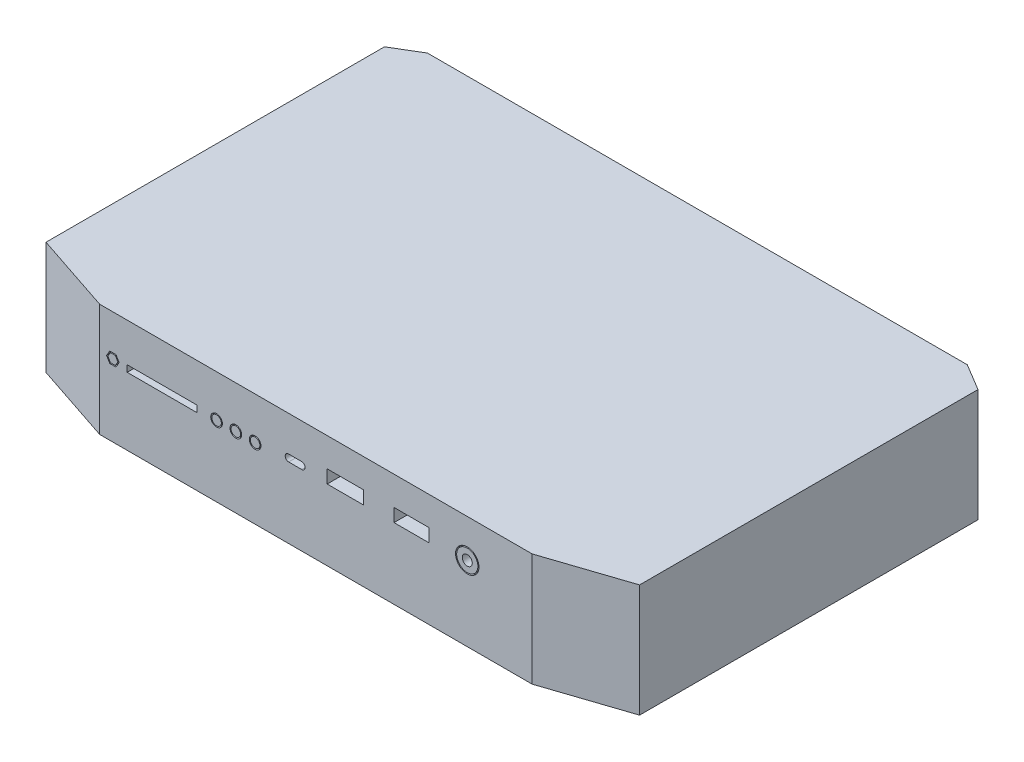
from build123d import *

# Parameters (mm, degrees)
SKETCH_1_W                   = 221
SKETCH_1_H                   = 142
EXTRUDE_1_DEPTH              = 42
HOLE_WIZARD_M2_1_D           = 1.6
HOLE_WIZARD_M2_1_DEPTH       = 6
HOLE_WIZARD_M2_1_CSINK_D     = 1.65
HOLE_WIZARD_M2_1_CSINK_ANGLE = 90
HOLE_WIZARD_M2_1_TIP         = 0.480688495
SKETCH_5_OUTSIDE_W           = 276.204
SKETCH_5_OUTSIDE_H           = 197.204
CUT_EXTRUDE_1_DEPTH          = 130
EXTRUDE_2_DEPTH              = 122
CUT_EXTRUDE_2_DEPTH          = 244
SKETCH_13_W                  = 16.438159635
SKETCH_13_H                  = 9.93572307
SKETCH_13_W_2                = 12.5754897
SKETCH_13_H_2                = 5.083708602
SKETCH_13_H_3                = 4.97630757
SKETCH_13_W_3                = 12.84305331
SKETCH_13_R                  = 2.136618389
SKETCH_13_R_2                = 4.382719539
CUT_EXTRUDE_3_DEPTH          = 5
SKETCH_14_R                  = 4.5
SKETCH_14_R_2                = 2.136618389
CUT_EXTRUDE_4_DEPTH          = 2
CUT_EXTRUDE_6_DEPTH          = 7
CUT_EXTRUDE_7_DEPTH          = 2
SKETCH_16_W                  = 25.979982462
SKETCH_16_H                  = 2.443258538
SKETCH_16_W_2                = 13.47848244
SKETCH_16_H_2                = 4.896726707
SKETCH_16_W_3                = 13.009082554
SKETCH_16_R                  = 1.865871028
CUT_EXTRUDE_8_DEPTH          = 7
SKETCH_16_3_R                = 4.363054392
SKETCH_16_3_R_2              = 3.946752021
SKETCH_16_3_R_3              = 2.173269591
SKETCH_16_3_R_4              = 1.773269591
CUT_EXTRUDE_9_DEPTH          = 1


with BuildPart() as part:
    # 草图1 → 凸台-拉伸1 (new body)
    with BuildSketch(Plane(origin=(0, 0, 0), x_dir=(1, 0, 0), z_dir=(0, 1, 0))):
        Rectangle(SKETCH_1_W, SKETCH_1_H)
    extrude(amount=EXTRUDE_1_DEPTH)

    # M2 螺纹孔的螺纹孔钻头1
    with Locations(Plane(origin=(0, 0, 0), x_dir=(-1, 0, 0), z_dir=(0, -1, 0))):
        with Locations((0, 45.7), (0, -46.4)):
            CounterSinkHole(HOLE_WIZARD_M2_1_D / 2, HOLE_WIZARD_M2_1_CSINK_D / 2, depth=HOLE_WIZARD_M2_1_DEPTH, counter_sink_angle=HOLE_WIZARD_M2_1_CSINK_ANGLE)
            with Locations((0, 0, -(HOLE_WIZARD_M2_1_DEPTH + HOLE_WIZARD_M2_1_TIP / 2))):  # 118° drill point
                Cone(0, HOLE_WIZARD_M2_1_D / 2, HOLE_WIZARD_M2_1_TIP, mode=Mode.SUBTRACT)

    # 草图5 outside → 切除-拉伸1 (cut)
    with BuildSketch(Plane.XZ):
        Rectangle(SKETCH_5_OUTSIDE_W, SKETCH_5_OUTSIDE_H)
        Polygon((-110.5, -65), (-100.5, -71), (100.5, -71), (110.5, -65), (110.5, 61), (80.5, 71), (-80.5, 71), (-110.5, 61), align=None, mode=Mode.SUBTRACT)
    extrude(amount=-CUT_EXTRUDE_1_DEPTH, mode=Mode.SUBTRACT)

    # 草图13 → 切除-拉伸3 (cut)
    with BuildSketch(Plane(origin=(0, 0, -71), x_dir=(-1, 0, 0), z_dir=(0, 0, -1))):
        with Locations((-62.342110878, 30.003254568)):
            Rectangle(SKETCH_13_W, SKETCH_13_H)
        with BuildLine():
            Line((14.946870507, 31.115026464), (9.712885643, 31.115026464))
            ThreePointArc((9.712885643, 31.115026464), (8.384859632, 29.787000454), (9.712885643, 28.458974443))
            Line((9.712885643, 28.458974443), (14.946870507, 28.458974443))
            ThreePointArc((14.946870507, 28.458974443), (16.274896517, 29.787000454), (14.946870507, 31.115026464))
        make_face()
        Polygon((39.457804396, 32.922800643), (25.386145104, 32.922800643), (25.386145104, 30.350561848), (27.466632365, 28.270074587), (37.377317135, 28.270074587), (39.457804396, 30.350561848), align=None)
        Polygon((56.866826337, 33.694786502), (48.092607233, 33.694786502), (48.092607233, 29.787000454), (50.08753298, 27.865629395), (54.87190059, 27.865629395), (56.866826337, 29.787000454), align=None)
        with Locations((-39.665036312, 34.649123031)):
            Rectangle(SKETCH_13_W_2, SKETCH_13_H_2)
        with Locations((-39.665036312, 25.319884014)):
            Rectangle(SKETCH_13_W_2, SKETCH_13_H_3)
        with Locations((-12.596517704, 34.649123031)):
            Rectangle(SKETCH_13_W_3, SKETCH_13_H_2)
        with Locations((-12.596517704, 25.319884014)):
            Rectangle(SKETCH_13_W_3, SKETCH_13_H_3)
        with Locations((-81.446088386, 29.134961074)):
            Circle(SKETCH_13_R)
        with Locations((79.401798223, 30.827059992)):
            Circle(SKETCH_13_R_2)
    extrude(amount=-CUT_EXTRUDE_3_DEPTH, mode=Mode.SUBTRACT)

    # 草图14 → 切除-拉伸4 (cut)
    with BuildSketch(Plane(origin=(0, 0, -71), x_dir=(-1, 0, 0), z_dir=(0, 0, -1))):
        with Locations((-81.446088386, 29.134961074)):
            Circle(SKETCH_14_R)
        with Locations((-81.446088386, 29.134961074)):
            Circle(SKETCH_14_R_2, mode=Mode.SUBTRACT)
    extrude(amount=-CUT_EXTRUDE_4_DEPTH, mode=Mode.SUBTRACT)

    # 草图15 → 切除-拉伸6 (cut)
    with BuildSketch(Plane(origin=(0, 0, -71), x_dir=(-1, 0, 0), z_dir=(0, 0, -1))):
        Polygon((-92.68249691, 18.806116893), (-99.112519076, 18.806116893), (-98.623712243, 14.751895509), (-92.011551822, 14.751895509), align=None)
        Polygon((-91.879157456, 13.951895509), (-98.527258342, 13.951895509), (-97.923276236, 8.942396867), (-91.050120709, 8.942396867), align=None)
        Polygon((-75.297304818, 18.806116893), (-91.871615743, 18.806116893), (-91.200670655, 14.751895509), (-75.518910584, 14.751895509), align=None)
        Polygon((-90.917726343, 8.142396867), (-97.826822335, 8.142396867), (-97.41192698, 4.70120598), (-90.348233485, 4.70120598), align=None)
        Polygon((-75.562638983, 13.951895509), (-91.068276288, 13.951895509), (-90.239239541, 8.942396867), (-75.344503007, 8.942396867), (-75.739635776, 10.713783989), align=None)
        Polygon((-52.578445405, 18.806116893), (-74.496110601, 18.806116893), (-74.717716367, 14.751895509), (-51.774906031, 14.751895509), align=None)
        Polygon((-75.166051774, 8.142396867), (-90.106845175, 8.142396867), (-89.537352317, 4.70120598), (-74.398445829, 4.70120598), align=None)
        Polygon((-51.616347473, 13.951895509), (-74.761444767, 13.951895509), (-74.934806928, 10.780278662), (-74.524841588, 8.942396867), (-51.42706551, 8.942396867), (-51.171481922, 11.707346593), align=None)
        Polygon((-35.075002191, 18.806116893), (-51.762883748, 18.806116893), (-50.959344374, 14.751895509), (-35.559384763, 14.751895509), align=None)
        Polygon((-51.50101509, 8.142396867), (-74.346390355, 8.142396867), (-73.57878441, 4.70120598), (-51.819108365, 4.70120598), align=None)
        Polygon((-35.654965645, 13.951895509), (-50.800785816, 13.951895509), (-50.364206681, 11.749155329), (-50.623654942, 8.942396867), (-35.465906232, 8.942396867), (-35.91251205, 11.663466241), (-35.914968536, 11.775703918), align=None)
        Polygon((-27.621866371, 18.806116893), (-34.269312608, 18.806116893), (-35.067158005, 12.128250961), (-28.090183444, 12.128250961), align=None)
        Polygon((-35.334603201, 8.142396867), (-50.697604522, 8.142396867), (-51.015697797, 4.70120598), (-34.769804712, 4.70120598), align=None)
        Polygon((-10.700016146, 18.806116893), (-26.819901511, 18.806116893), (-27.104223046, 14.751895509), (-11.123179659, 14.751895509), align=None)
        Polygon((-11.206680479, 13.951895509), (-27.160326846, 13.951895509), (-27.315234796, 11.74301913), (-26.910700469, 8.942396867), (-11.316391293, 8.942396867), (-11.541621065, 10.742915426), align=None)
        Polygon((0, 18.806116893), (-9.895670209, 18.806116893), (-10.318833722, 14.751895509), (0, 14.751895509), align=None)
        Polygon((-11.216318002, 8.142396867), (-26.795144914, 8.142396867), (-26.298084008, 4.70120598), (-10.785853882, 4.70120598), align=None)
        Polygon((0, 13.951895509), (-10.402334542, 13.951895509), (-10.736415925, 10.751147225), (-10.510156424, 8.942396867), (0, 8.942396867), align=None)
        Polygon((0, 8.142396867), (-10.410083134, 8.142396867), (-9.979619013, 4.70120598), (0, 4.70120598), align=None)
    cut_extrude_6 = extrude(amount=-CUT_EXTRUDE_6_DEPTH, mode=Mode.SUBTRACT)

    # 草图15<4> → 切除-拉伸7 (cut)
    with BuildSketch(Plane(origin=(0, 0, -71), x_dir=(-1, 0, 0), z_dir=(0, 0, -1))):
        Polygon((-35.046789874, 11.328250961), (-33.959101014, 4.70120598), (-27.106386604, 4.70120598), (-28.063626434, 11.328250961), align=None)
    cut_extrude_7 = extrude(amount=-CUT_EXTRUDE_7_DEPTH, mode=Mode.SUBTRACT)

    # 镜向2: 切除-拉伸6, 切除-拉伸7 across plane
    add(cut_extrude_6.mirror(Plane(origin=(0, 0, 0), x_dir=(0, 0, 1), z_dir=(1, 0, 0))), mode=Mode.SUBTRACT)
    add(cut_extrude_7.mirror(Plane(origin=(0, 0, 0), x_dir=(0, 0, 1), z_dir=(1, 0, 0))), mode=Mode.SUBTRACT)

    # 草图16 → 切除-拉伸8 (cut)
    with BuildSketch(Plane.XY.offset(71)):
        with Locations((-57.281831916, 26.377251365)):
            Rectangle(SKETCH_16_W, SKETCH_16_H)
        with Locations((10.932843302, 28.825614719)):
            Rectangle(SKETCH_16_W_2, SKETCH_16_H_2)
        with Locations((35.576337315, 28.825614719)):
            Rectangle(SKETCH_16_W_3, SKETCH_16_H_2)
        with BuildLine():
            Line((-5.285154143, 28.877937385), (-10.167035199, 28.877937385))
            ThreePointArc((-10.167035199, 28.877937385), (-11.44609195, 27.598880634), (-10.167035199, 26.319823884))
            Line((-10.167035199, 26.319823884), (-5.285154143, 26.319823884))
            ThreePointArc((-5.285154143, 26.319823884), (-4.006097392, 27.598880634), (-5.285154143, 28.877937385))
        make_face()
        with Locations((56.345016865, 27.845527617)):
            Circle(SKETCH_16_R)
    extrude(amount=-CUT_EXTRUDE_8_DEPTH, mode=Mode.SUBTRACT)

    # 草图16<3> → 切除-拉伸9 (cut)
    # profile 1 of 6: a face of its own
    with BuildSketch(Plane.XY.offset(71)):
        Polygon((-76.770755402, 24.764960279), (-74.440373998, 24.764960279), (-73.275183296, 26.783129776), (-74.440373998, 28.801299272), (-76.770755402, 28.801299272), (-77.935946104, 26.783129776), align=None)
        Polygon((-73.737063512, 26.783129776), (-74.671314106, 25.164960279), (-76.539815295, 25.164960279), (-77.474065889, 26.783129776), (-76.539815295, 28.401299272), (-74.671314106, 28.401299272), align=None, mode=Mode.SUBTRACT)
    # profile 2 of 6: a face of its own
    with BuildSketch(Plane.XY.offset(71)):
        Polygon((78.103657754, -9.292426429), (75.148738306, -4.174355814), (69.238899411, -4.174355814), (66.283979963, -9.292426429), (69.238899411, -14.410497045), (75.148738306, -14.410497045), align=None)
    # profile 3 of 6: a face of its own
    with BuildSketch(Plane.XY.offset(71)):
        with Locations((56.345016865, 27.845527617)):
            Circle(SKETCH_16_3_R)
        with Locations((56.345016865, 27.845527617)):
            Circle(SKETCH_16_3_R_2, mode=Mode.SUBTRACT)
    # profile 4 of 6: a face of its own
    with BuildSketch(Plane.XY.offset(71)):
        with Locations((-37.002404568, 26.319823884)):
            Circle(SKETCH_16_3_R_3)
        with Locations((-37.002404568, 26.319823884)):
            Circle(SKETCH_16_3_R_4, mode=Mode.SUBTRACT)
    # profile 5 of 6: a face of its own
    with BuildSketch(Plane.XY.offset(71)):
        with Locations((-29.823701778, 26.319823884)):
            Circle(SKETCH_16_3_R_3)
        with Locations((-29.823701778, 26.319823884)):
            Circle(SKETCH_16_3_R_4, mode=Mode.SUBTRACT)
    # profile 6 of 6: a face of its own
    with BuildSketch(Plane.XY.offset(71)):
        with Locations((-22.644998988, 26.319823884)):
            Circle(SKETCH_16_3_R_3)
        with Locations((-22.644998988, 26.319823884)):
            Circle(SKETCH_16_3_R_4, mode=Mode.SUBTRACT)
    extrude(amount=-CUT_EXTRUDE_9_DEPTH, mode=Mode.SUBTRACT)


with BuildPart() as body_2:
    # 草图10 → 凸台-拉伸2 (new, symmetric)
    with BuildSketch(Plane(origin=(0, 0, 0), x_dir=(0, 0, -1), z_dir=(1, 0, 0))):
        Polygon((50, 0), (51, -3.3), (57, 0), align=None)
    extrude(amount=EXTRUDE_2_DEPTH, both=True)

    # 草图11 → 切除-拉伸2 (cut, along a direction that is not the sketch's normal)
    with BuildSketch(Plane(origin=(-68.014194464, -41.220723918, -34.007097232), x_dir=(-0.33623276510419403, -0.20377743339648416, 0.9194684797798832), z_dir=(-0.7863274500900225, -0.47656209096365676, -0.39316372504501307))):
        Polygon((-25.006732991, 42.241589862), (-18.481223817, 39.937738734), (-17.393638955, 44.055645868), align=None)
    cut_extrude_2 = extrude(amount=CUT_EXTRUDE_2_DEPTH, dir=(-1, 0, 0), mode=Mode.SUBTRACT)

    # 镜向1: 切除-拉伸2 across plane
    add(cut_extrude_2.mirror(Plane(origin=(0, 0, 0), x_dir=(0, 0, 1), z_dir=(1, 0, 0))), mode=Mode.SUBTRACT)


with BuildPart() as body_3:
    # 镜向4: mirrored copy
    add(body_2.part.mirror(Plane(origin=(0, 0, 1), x_dir=(1, 0, 0), z_dir=(0, 0, -1))))


solid = Compound([part.part, body_2.part, body_3.part])
